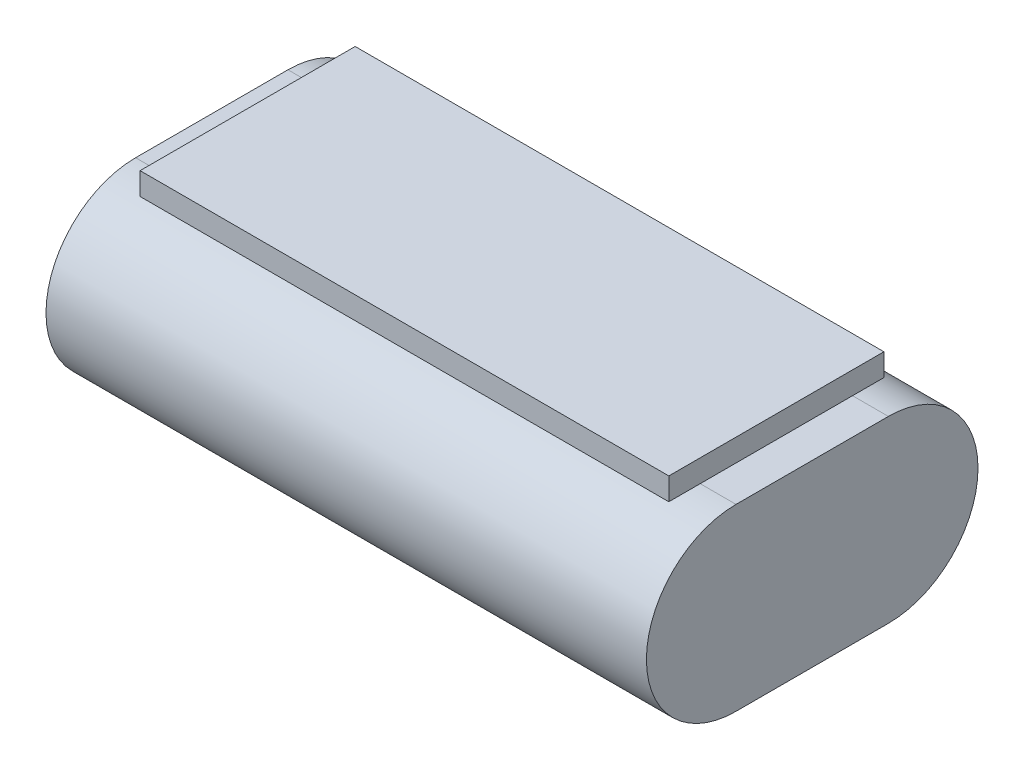
from build123d import *

# Parameters (mm, degrees)
EXTRUDE_1_DEPTH = 33.5
SKETCH_2_W      = 59
SKETCH_2_H      = 24
EXTRUDE_2_DEPTH = 2.5


with BuildPart() as part:
    # 草图1 → 凸台-拉伸1 (new, symmetric)
    with BuildSketch(Plane(origin=(0, 0, 0), x_dir=(0, 0, -1), z_dir=(1, 0, 0))):
        with BuildLine():
            Line((-8.5, 10), (8.5, 10))
            ThreePointArc((8.5, 10), (18.5, 0), (8.5, -10))
            Line((8.5, -10), (-8.5, -10))
            ThreePointArc((-8.5, -10), (-18.5, 0), (-8.5, 10))
        make_face()
    extrude(amount=EXTRUDE_1_DEPTH, both=True)

    # 草图2 → 凸台-拉伸2 (add)
    with BuildSketch(Plane(origin=(0, 10, 0), x_dir=(1, 0, 0), z_dir=(0, 1, 0))):
        Rectangle(SKETCH_2_W, SKETCH_2_H)
    extrude(amount=EXTRUDE_2_DEPTH)


solid = part.part
